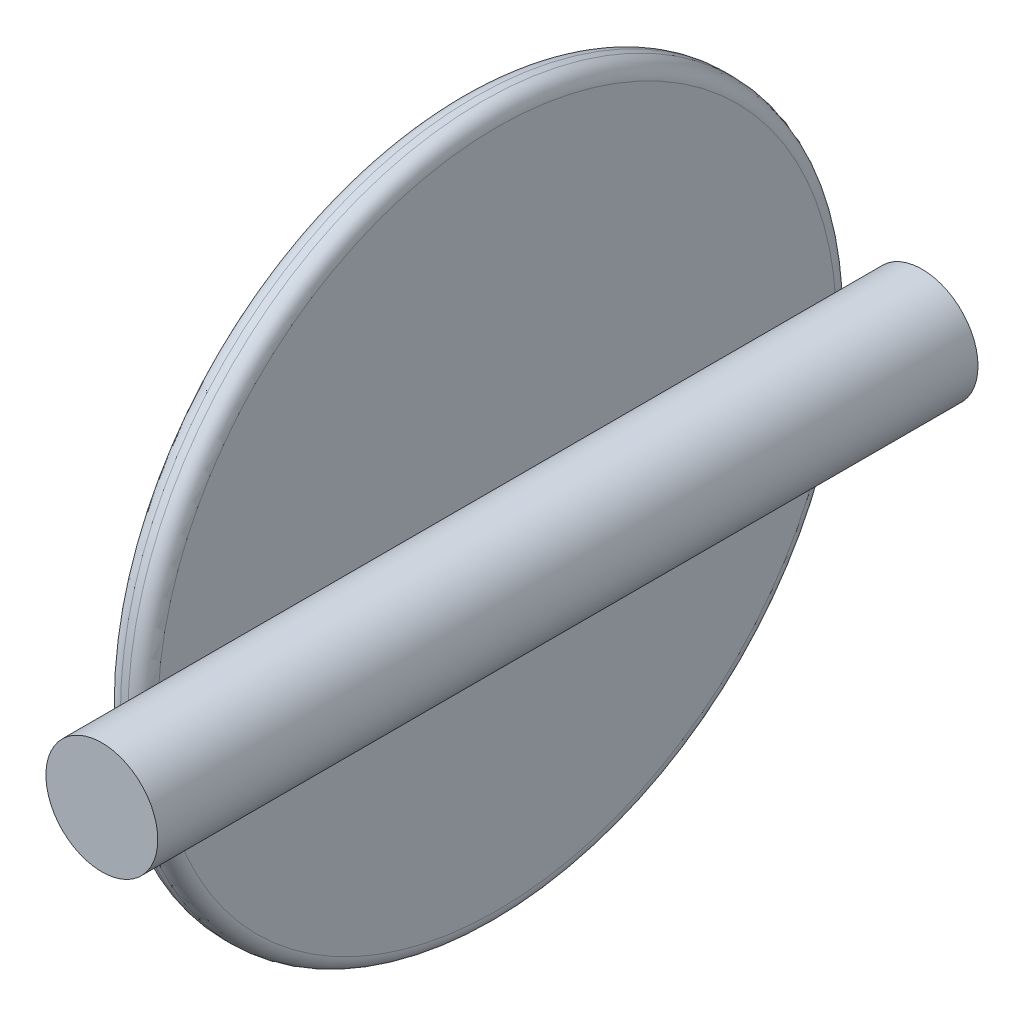
from build123d import *

# Parameters (mm, degrees)
SKETCH1_R                = 47.5
BOSS_EXTRUDE1_DEPTH      = 5
FILLET1_R                = 2
BOSS_EXTRUDE2_DEPTH      = 60
BOSS_EXTRUDE2_DEPTH_BACK = 50
SKETCH2_R                = 7.5


with BuildPart() as part:
    # Sketch1 → Boss-Extrude1 (new body)
    with BuildSketch(Plane(origin=(0, 0, 0), x_dir=(0, 0, -1), z_dir=(1, 0, 0))):
        Circle(SKETCH1_R)
    extrude(amount=BOSS_EXTRUDE1_DEPTH)

    # Fillet1
    fillet1_edges = [part.edges().sort_by_distance(p)[0] for p in [
        (0, 0, 47.5),
        (5, 0, 47.5),
    ]]
    fillet(fillet1_edges, radius=FILLET1_R)

    # Sketch2 → Boss-Extrude2 (add, two sides: drawn at the far end of the back side and taken through both)
    with BuildSketch(Plane.XY.offset(-BOSS_EXTRUDE2_DEPTH_BACK)):
        with Locations((12, 0)):
            Circle(SKETCH2_R)
    extrude(amount=BOSS_EXTRUDE2_DEPTH + BOSS_EXTRUDE2_DEPTH_BACK)


solid = part.part
